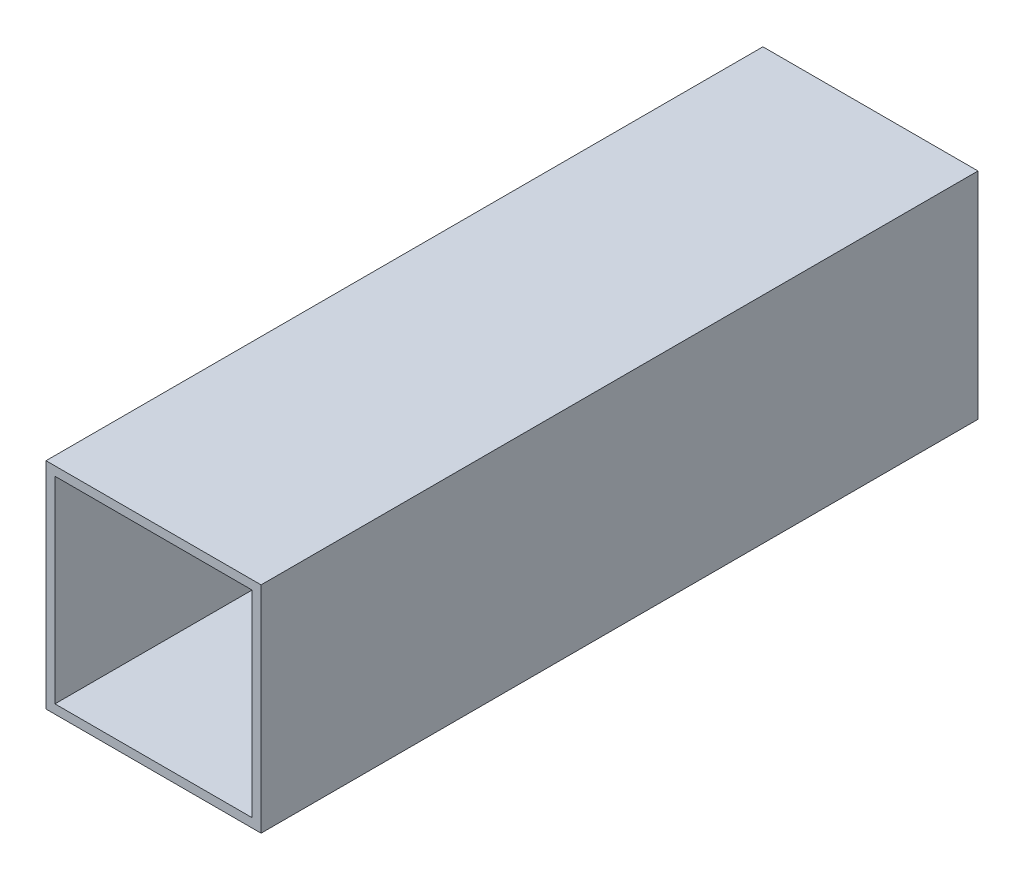
from build123d import *

# Parameters (mm, degrees)
SKETCH2_W           = 38.1
SKETCH2_H           = 38.1
SKETCH2_W_2         = 34.925
SKETCH2_H_2         = 34.925
BOSS_EXTRUDE1_DEPTH = 127


with BuildPart() as part:
    # Sketch2 → Boss-Extrude1 (new body)
    with BuildSketch(Plane.XY):
        with Locations((19.05, 19.05)):
            Rectangle(SKETCH2_W, SKETCH2_H)
        with Locations((19.05, 19.05)):
            Rectangle(SKETCH2_W_2, SKETCH2_H_2, mode=Mode.SUBTRACT)
    extrude(amount=BOSS_EXTRUDE1_DEPTH)


solid = part.part
